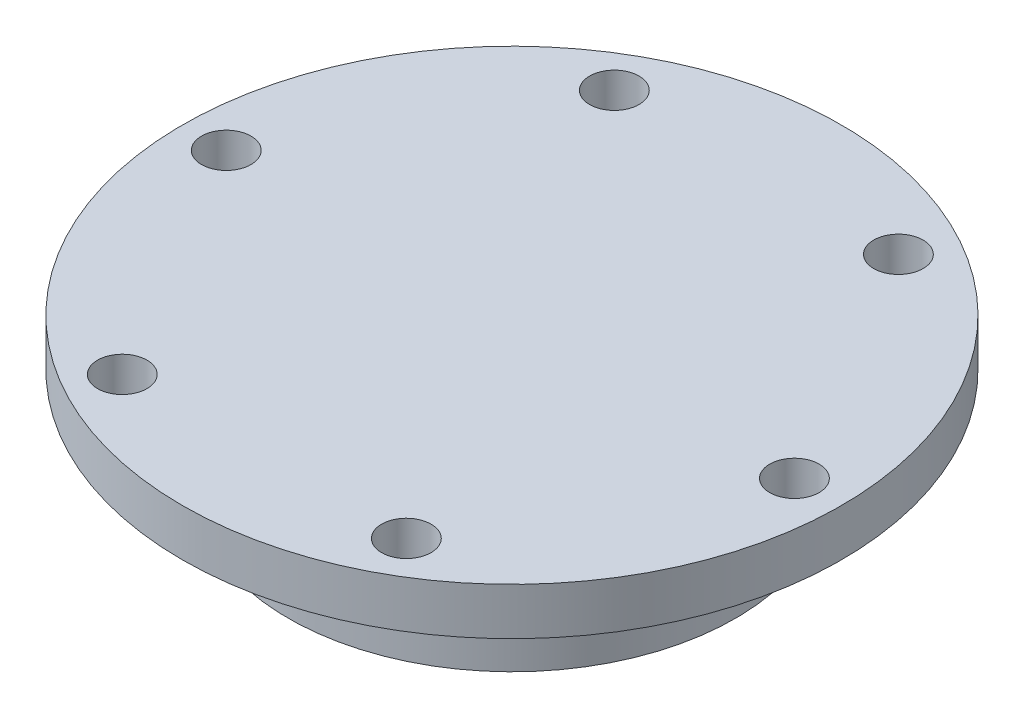
from build123d import *

# Parameters (mm, degrees)
CROQUIS1_R              = 70
SALIENTE_EXTRUIR1_DEPTH = 10
CROQUIS4_R              = 47.5
SALIENTE_EXTRUIR2_DEPTH = 22
MATRIZC1_COUNT          = 6


with BuildPart() as part:
    # Croquis1 → Saliente-Extruir1 (new body)
    with BuildSketch(Plane(origin=(0, 0, 0), x_dir=(1, 0, 0), z_dir=(0, 1, 0))):
        with Locations(Location((0, 0, 0), (0, 0, 270))):
            Circle(CROQUIS1_R)
    extrude(amount=SALIENTE_EXTRUIR1_DEPTH)

    # Croquis4 → Saliente-Extruir2 (add)
    with BuildSketch(Plane(origin=(0, 0, 0), x_dir=(-1, 0, 0), z_dir=(0, -1, 0))):
        with Locations(Location((0, 0, 0), (0, 0, 90))):
            Circle(CROQUIS4_R)
    extrude(amount=SALIENTE_EXTRUIR2_DEPTH)

    # Croquis6 → Perforador para roscar para macho de roscar para M12x1.51 (revolve, cut)
    with BuildSketch(Plane(origin=(60, 10, 0), x_dir=(0, 0, 1), z_dir=(1, 0, 0))):
        Polygon((0, 0), (0, 46.65451825), (5.25, 43.5), (5.25, 0), align=None)
    perforador_para_roscar_para_macho_de_ros = revolve(axis=Axis((60, 16.35, 0), (0, -1, 0)), mode=Mode.SUBTRACT)

    # MatrizC1: Perforador para roscar para macho de roscar para M12x1.51 ×6 about axis
    matrizc1_axis = Axis((-0.339409177, 0, 0), (0, 1, 0))
    for i in range(1, MATRIZC1_COUNT):
        add(perforador_para_roscar_para_macho_de_ros.rotate(matrizc1_axis, i * 360 / MATRIZC1_COUNT), mode=Mode.SUBTRACT)


solid = part.part
